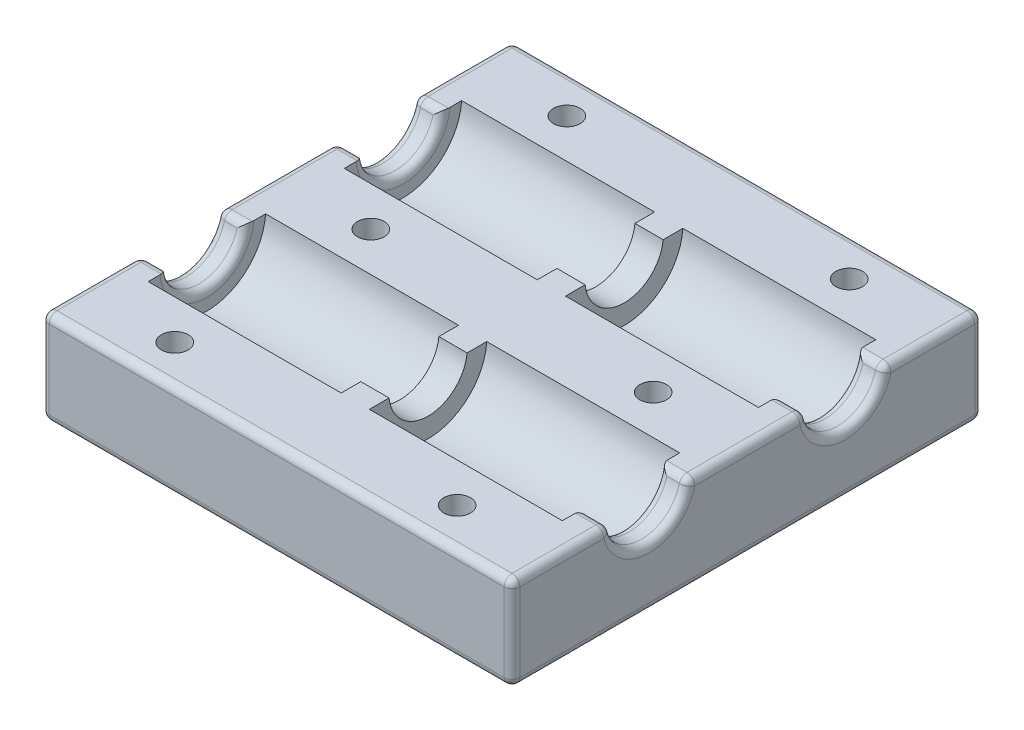
from build123d import *

# Parameters (mm, degrees)
SKETCH1_W           = 60
SKETCH1_H           = 60
BOSS_EXTRUDE1_DEPTH = 25
CUT_EXTRUDE1_REACH  = 73.589
SKETCH2_R           = 7.5
SKETCH3_R           = 2
CUT_EXTRUDE2_DEPTH  = 5
SKETCH7_R           = 7.5
BOSS_EXTRUDE2_DEPTH = 1.8
SKETCH8_R           = 7.5
SKETCH8_R_2         = 5
BOSS_EXTRUDE3_DEPTH = 3.6
SKETCH4_W           = 60
SKETCH4_H           = 1
CUT_EXTRUDE3_DEPTH  = 72.589105316
SKETCH5_R           = 1.7
CUT_EXTRUDE4_DEPTH  = 45.09081537
FILLET1_R           = 1
SKETCH9_R           = 5
CUT_EXTRUDE5_DEPTH  = 69.146900167


with BuildPart() as part:
    # Sketch1 → Boss-Extrude1 (new body)
    with BuildSketch(Plane(origin=(0, 0, 0), x_dir=(1, 0, 0), z_dir=(0, 1, 0))):
        Rectangle(SKETCH1_W, SKETCH1_H)
    extrude(amount=BOSS_EXTRUDE1_DEPTH)

    # Sketch2 → Cut-Extrude1 (cut, up to next)
    with BuildSketch(Plane(origin=(30, 0, 0), x_dir=(0, 0, -1), z_dir=(1, 0, 0)), mode=Mode.PRIVATE) as cut_extrude1_sk1:
        with Locations((-12.5, 12.5)):
            Circle(SKETCH2_R)
    cut_extrude1_tool1 = extrude(cut_extrude1_sk1.sketch, amount=-CUT_EXTRUDE1_REACH, mode=Mode.PRIVATE) & part.part
    # Sketch2 → Cut-Extrude1 (cut, up to next)
    with BuildSketch(Plane(origin=(30, 0, 0), x_dir=(0, 0, -1), z_dir=(1, 0, 0)), mode=Mode.PRIVATE) as cut_extrude1_sk2:
        with Locations((12.5, 12.5)):
            Circle(SKETCH2_R)
    cut_extrude1_tool2 = extrude(cut_extrude1_sk2.sketch, amount=-CUT_EXTRUDE1_REACH, mode=Mode.PRIVATE) & part.part
    add(cut_extrude1_tool1.solids().sort_by_distance((30, 12.5, 12.5))[0], mode=Mode.SUBTRACT)
    add(cut_extrude1_tool2.solids().sort_by_distance((30, 12.5, -12.5))[0], mode=Mode.SUBTRACT)

    # Sketch3 → Cut-Extrude2 (cut)
    with BuildSketch(Plane(origin=(0, 25, 0), x_dir=(1, 0, 0), z_dir=(0, 1, 0))):
        with Locations(Location((0, 25, 0), (0, 0, 270))):
            Circle(SKETCH3_R)
        with Locations(Location((0, -25, 0), (0, 0, 270))):
            Circle(SKETCH3_R)
        with Locations(Location((-25, 25, 0), (0, 0, 270))):
            Circle(SKETCH3_R)
        with Locations(Location((-25, -25, 0), (0, 0, 270))):
            Circle(SKETCH3_R)
        with Locations(Location((25, -25, 0), (0, 0, 270))):
            Circle(SKETCH3_R)
        with Locations(Location((25, 25, 0), (0, 0, 270))):
            Circle(SKETCH3_R)
    extrude(amount=-CUT_EXTRUDE2_DEPTH, mode=Mode.SUBTRACT)

    # Sketch7 → Boss-Extrude2 (add, symmetric)
    with BuildSketch(Plane(origin=(0, 0, 0), x_dir=(0, 0, -1), z_dir=(1, 0, 0))):
        with Locations((12.5, 12.5)):
            Circle(SKETCH7_R)
        with Locations((-12.5, 12.5)):
            Circle(SKETCH7_R)
    extrude(amount=BOSS_EXTRUDE2_DEPTH, both=True)

    # Sketch8 → Boss-Extrude3 (add)
    # profile 1 of 2: a face of its own
    with BuildSketch(Plane(origin=(30, 0, 0), x_dir=(0, 0, -1), z_dir=(1, 0, 0))):
        with Locations((12.5, 12.5)):
            Circle(SKETCH8_R)
        with Locations((12.5, 12.5)):
            Circle(SKETCH8_R_2, mode=Mode.SUBTRACT)
    # profile 2 of 2: a face of its own
    with BuildSketch(Plane(origin=(30, 0, 0), x_dir=(0, 0, -1), z_dir=(1, 0, 0))):
        with Locations((-12.5, 12.5)):
            Circle(SKETCH8_R)
        with Locations((-12.5, 12.5)):
            Circle(SKETCH8_R_2, mode=Mode.SUBTRACT)
    boss_extrude3 = extrude(amount=-BOSS_EXTRUDE3_DEPTH)

    # Mirror1: Boss-Extrude3 across plane
    add(boss_extrude3.mirror(Plane(origin=(0, 0, 0), x_dir=(0, 0, 1), z_dir=(1, 0, 0))))

    # Sketch4 → Cut-Extrude3 (cut, through all)
    with BuildSketch(Plane(origin=(30, 0, 0), x_dir=(0, 0, -1), z_dir=(1, 0, 0))):
        with Locations((0, 12.5)):
            Rectangle(SKETCH4_W, SKETCH4_H)
    extrude(amount=-CUT_EXTRUDE3_DEPTH, mode=Mode.SUBTRACT)


with BuildPart() as cut_extrude3_kept_piece:
    # of the separate pieces the step leaves, the one the design keeps (cut_extrude3_pieces_kept)
    add(part.part.solids().sort_by_distance((-30, 0, 30))[0])

    # Sketch5 → Cut-Extrude4 (cut, through all)
    with BuildSketch(Plane(origin=(0, 12, 0), x_dir=(1, 0, 0), z_dir=(0, 1, 0))):
        with Locations(Location((-18, -24.991657387, 0), (0, 0, 270))):
            Circle(SKETCH5_R)
        with Locations(Location((18, -24.991657387, 0), (0, 0, 270))):
            Circle(SKETCH5_R)
        with Locations(Location((18, 24.991657387, 0), (0, 0, 270))):
            Circle(SKETCH5_R)
        with Locations(Location((-18, 24.991657387, 0), (0, 0, 270))):
            Circle(SKETCH5_R)
        with Locations(Location((18, 0, 0), (0, 0, 270))):
            Circle(SKETCH5_R)
        with Locations(Location((-18, 0, 0), (0, 0, 270))):
            Circle(SKETCH5_R)
    extrude(amount=-CUT_EXTRUDE4_DEPTH, mode=Mode.SUBTRACT)

    # Fillet1
    fillet1_edges = [cut_extrude3_kept_piece.edges().sort_by_distance(p)[0] for p in [
        (-26.4, 7.5, -12.5),
        (-30, 7.5, -12.5),
        (-26.4, 7.5, 12.5),
        (-30, 7.5, 12.5),
        (26.4, 7.5, -12.5),
        (30, 7.5, -12.5),
        (26.4, 7.5, 12.5),
        (30, 7.5, 12.5),
        (30, 6, 30),
        (-30, 6, 30),
        (-30, 6, -30),
        (30, 6, -30),
        (30, 12, 0),
        (30, 12, 23.737468593),
        (30, 12, -23.737468593),
        (28.2, 12, 7.525062814),
        (28.2, 12, 17.474937186),
        (-30, 12, 23.737468593),
        (-30, 12, 0),
        (-30, 12, -23.737468593),
        (0, 12, -30),
        (28.2, 12, -17.474937186),
        (28.2, 12, -7.525062814),
        (-28.2, 12, 7.525062814),
        (-28.2, 12, 17.474937186),
        (-28.2, 12, -17.474937186),
        (-28.2, 12, -7.525062814),
        (0, 12, 30),
        (0, 0, 30),
        (-30, 0, 0),
        (0, 0, -30),
        (30, 0, 0),
    ]]
    fillet(fillet1_edges, radius=FILLET1_R)

    # Sketch9 → Cut-Extrude5 (cut, through all)
    with BuildSketch(Plane(origin=(30, 0, 0), x_dir=(0, 0, -1), z_dir=(1, 0, 0))):
        with Locations((12.5, 12.5)):
            Circle(SKETCH9_R)
        with Locations((-12.5, 12.5)):
            Circle(SKETCH9_R)
    extrude(amount=-CUT_EXTRUDE5_DEPTH, mode=Mode.SUBTRACT)


solid = cut_extrude3_kept_piece.part
